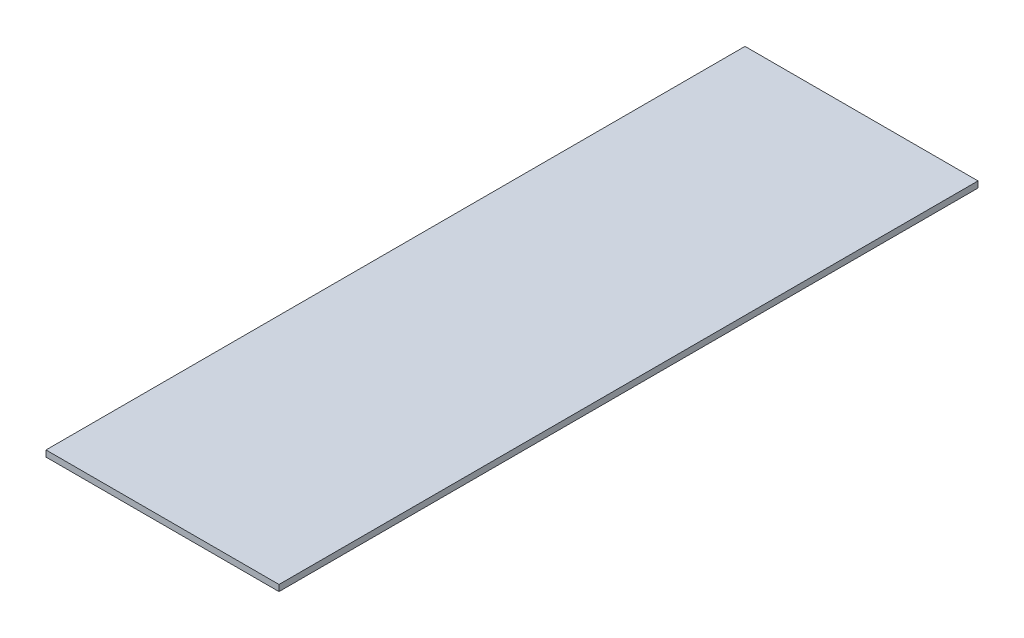
from build123d import *

# Parameters (mm, degrees)
SKETCH1_W           = 19.05
SKETCH1_H           = 57.15
BOSS_EXTRUDE1_DEPTH = 0.508


with BuildPart() as part:
    # Sketch1 → Boss-Extrude1 (new body)
    with BuildSketch(Plane(origin=(0, 0, 0), x_dir=(1, 0, 0), z_dir=(0, 1, 0))):
        Rectangle(SKETCH1_W, SKETCH1_H)
    extrude(amount=BOSS_EXTRUDE1_DEPTH)


solid = part.part
